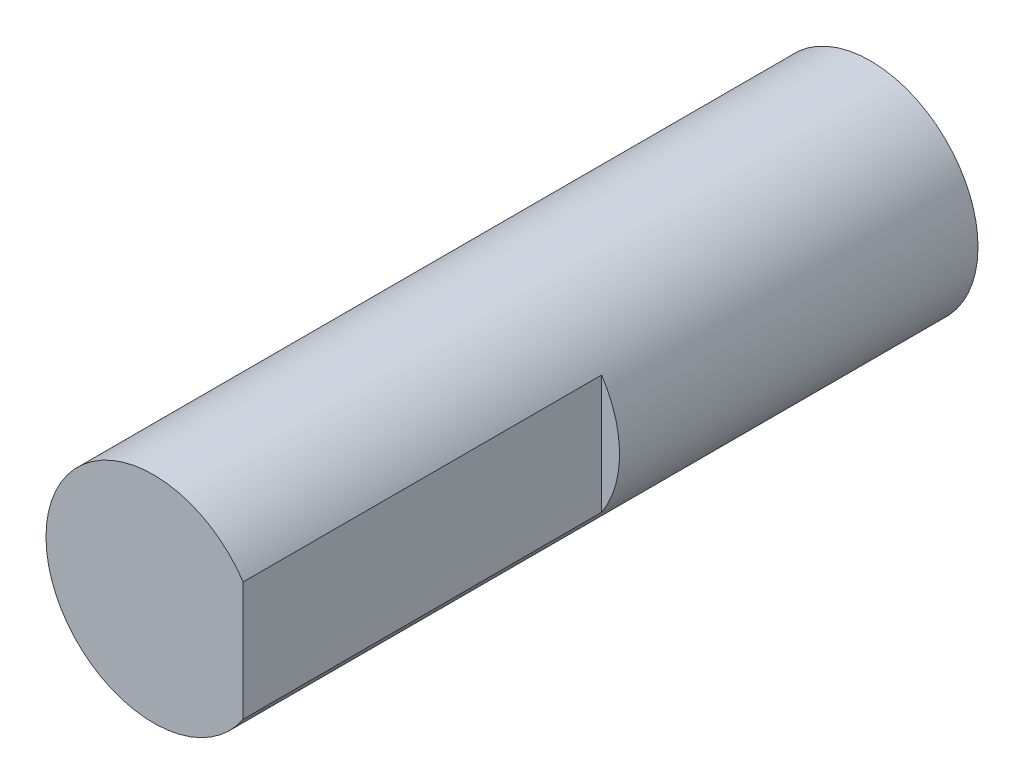
from build123d import *

# Parameters (mm, degrees)
SKETCH1_R           = 3
BOSS_EXTRUDE1_DEPTH = 20
CUT_EXTRUDE1_START  = -10
CUT_EXTRUDE1_DEPTH  = 10


with BuildPart() as part:
    # Sketch1 → Boss-Extrude1 (new body)
    with BuildSketch(Plane.XY):
        Circle(SKETCH1_R)
    extrude(amount=BOSS_EXTRUDE1_DEPTH)

    # Sketch2 → Cut-Extrude1 (cut)
    with BuildSketch(Plane.XY.offset(20).offset(CUT_EXTRUDE1_START)):
        with BuildLine():
            Line((2.5, 1.658312395), (2.5, -1.658312395))
            ThreePointArc((2.5, -1.658312395), (3, 0), (2.5, 1.658312395))
        make_face()
    extrude(amount=CUT_EXTRUDE1_DEPTH, mode=Mode.SUBTRACT)


solid = part.part
